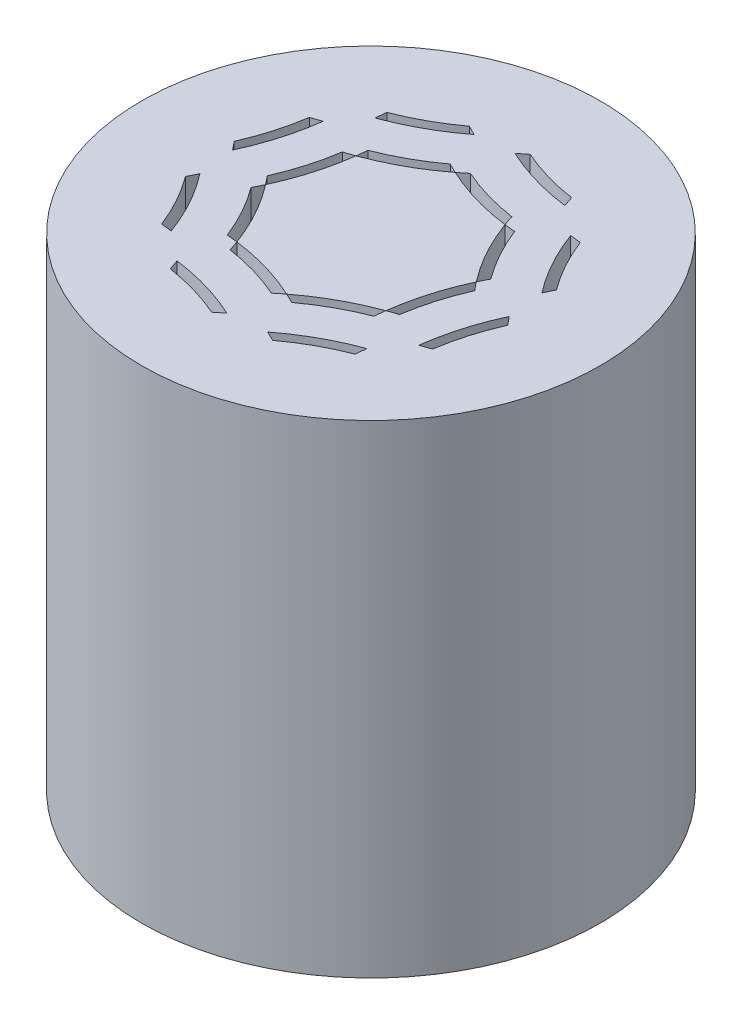
from build123d import *

# Parameters (mm, degrees)
SKETCH1_R           = 4.75
BOSS_EXTRUDE1_DEPTH = 10
CUT_EXTRUDE8_DEPTH  = 10
BOSS_EXTRUDE2_DEPTH = 10
CUT_EXTRUDE9_DEPTH  = 10
CIRPATTERN1_COUNT   = 8
SCALE3_SCALE        = 5
SKETCH7_R           = 8.75
BOSS_EXTRUDE3_DEPTH = 5


with BuildPart() as part:
    # Sketch1 → Boss-Extrude1 (new body)
    with BuildSketch(Plane(origin=(0, 0, 0), x_dir=(1, 0, 0), z_dir=(0, 1, 0))):
        with Locations(Location((0, 0, 0), (0, 0, 270))):
            Circle(SKETCH1_R)
    extrude(amount=BOSS_EXTRUDE1_DEPTH)

    # Sketch2 → Cut-Extrude8 (cut)
    with BuildSketch(Plane(origin=(0, 10, 0), x_dir=(1, 0, 0), z_dir=(0, 1, 0))):
        with BuildLine():
            ThreePointArc((-0.218792633, 1.963882563), (-0.319780571, 2.012220784), (-0.419649419, 2.062830667))
            ThreePointArc((-0.419649419, 2.062830667), (-0.949572254, 1.723202116), (-1.519747642, 1.456620438))
            ThreePointArc((-1.519747642, 1.456620438), (-1.530306935, 1.345159016), (-1.543384432, 1.233964924))
            ThreePointArc((-1.543384432, 1.233964924), (-0.853047192, 1.54803673), (-0.218792633, 1.963882563))
        make_face()
        with BuildLine():
            ThreePointArc((-0.044637674, 2.104610052), (-0.145319358, 2.150297375), (-0.244910404, 2.198315668))
            ThreePointArc((-0.244910404, 2.198315668), (-0.331491458, 2.129556275), (-0.419649419, 2.062830667))
            ThreePointArc((-0.419649419, 2.062830667), (-0.319780571, 2.012220784), (-0.218792633, 1.963882563))
            ThreePointArc((-0.218792633, 1.963882563), (-0.130919349, 2.033261473), (-0.044637674, 2.104610052))
        make_face()
        with BuildLine():
            ThreePointArc((1.161904603, 1.755378503), (0.547038921, 1.889936882), (-0.044637674, 2.104610052))
            ThreePointArc((-0.044637674, 2.104610052), (-0.130919349, 2.033261473), (-0.218792633, 1.963882563))
            ThreePointArc((-0.218792633, 1.963882563), (0.491431815, 1.697822724), (1.233964924, 1.543384432))
            ThreePointArc((1.233964924, 1.543384432), (1.196735951, 1.648973971), (1.161904603, 1.755378503))
        make_face()
        with BuildLine():
            ThreePointArc((1.381266108, 1.727621723), (1.271423825, 1.740223541), (1.161904603, 1.755378503))
            ThreePointArc((1.161904603, 1.755378503), (1.196735951, 1.648973971), (1.233964924, 1.543384432))
            ThreePointArc((1.233964924, 1.543384432), (1.345159016, 1.530306935), (1.456620438, 1.519747642))
            ThreePointArc((1.456620438, 1.519747642), (1.417733552, 1.623246159), (1.381266108, 1.727621723))
        make_face()
        with BuildLine():
            ThreePointArc((1.456620438, 1.519747642), (1.345159016, 1.530306935), (1.233964924, 1.543384432))
            ThreePointArc((1.233964924, 1.543384432), (1.54803673, 0.853047192), (1.963882563, 0.218792633))
            ThreePointArc((1.963882563, 0.218792633), (2.012220784, 0.319780571), (2.062830667, 0.419649419))
            ThreePointArc((2.062830667, 0.419649419), (1.723202116, 0.949572254), (1.456620438, 1.519747642))
        make_face()
        with BuildLine():
            ThreePointArc((2.062830667, 0.419649419), (2.012220784, 0.319780571), (1.963882563, 0.218792633))
            ThreePointArc((1.963882563, 0.218792633), (2.033261473, 0.130919349), (2.104610052, 0.044637674))
            ThreePointArc((2.104610052, 0.044637674), (2.150297375, 0.145319358), (2.198315668, 0.244910404))
            ThreePointArc((2.198315668, 0.244910404), (2.129556275, 0.331491458), (2.062830667, 0.419649419))
        make_face()
        with BuildLine():
            ThreePointArc((2.104610052, 0.044637674), (2.033261473, 0.130919349), (1.963882563, 0.218792633))
            ThreePointArc((1.963882563, 0.218792633), (1.697822724, -0.491431815), (1.543384432, -1.233964924))
            ThreePointArc((1.543384432, -1.233964924), (1.648973971, -1.196735951), (1.755378503, -1.161904603))
            ThreePointArc((1.755378503, -1.161904603), (1.889936882, -0.547038921), (2.104610052, 0.044637674))
        make_face()
        with BuildLine():
            ThreePointArc((1.755378503, -1.161904603), (1.648973971, -1.196735951), (1.543384432, -1.233964924))
            ThreePointArc((1.543384432, -1.233964924), (1.530306935, -1.345159016), (1.519747642, -1.456620438))
            ThreePointArc((1.519747642, -1.456620438), (1.623246159, -1.417733552), (1.727621723, -1.381266108))
            ThreePointArc((1.727621723, -1.381266108), (1.740223541, -1.271423825), (1.755378503, -1.161904603))
        make_face()
        with BuildLine():
            ThreePointArc((1.519747642, -1.456620438), (1.530306935, -1.345159016), (1.543384432, -1.233964924))
            ThreePointArc((1.543384432, -1.233964924), (0.853047192, -1.54803673), (0.218792633, -1.963882563))
            ThreePointArc((0.218792633, -1.963882563), (0.319780571, -2.012220784), (0.419649419, -2.062830667))
            ThreePointArc((0.419649419, -2.062830667), (0.949572254, -1.723202116), (1.519747642, -1.456620438))
        make_face()
        with BuildLine():
            ThreePointArc((0.419649419, -2.062830667), (0.319780571, -2.012220784), (0.218792633, -1.963882563))
            ThreePointArc((0.218792633, -1.963882563), (0.130919349, -2.033261473), (0.044637674, -2.104610052))
            ThreePointArc((0.044637674, -2.104610052), (0.145319358, -2.150297375), (0.244910404, -2.198315668))
            ThreePointArc((0.244910404, -2.198315668), (0.331491458, -2.129556275), (0.419649419, -2.062830667))
        make_face()
        with BuildLine():
            ThreePointArc((0.218792633, -1.963882563), (-0.491431815, -1.697822724), (-1.233964924, -1.543384432))
            ThreePointArc((-1.233964924, -1.543384432), (-1.196735951, -1.648973971), (-1.161904603, -1.755378503))
            ThreePointArc((-1.161904603, -1.755378503), (-0.547038921, -1.889936882), (0.044637674, -2.104610052))
            ThreePointArc((0.044637674, -2.104610052), (0.130919349, -2.033261473), (0.218792633, -1.963882563))
        make_face()
        with BuildLine():
            ThreePointArc((-1.161904603, -1.755378503), (-1.196735951, -1.648973971), (-1.233964924, -1.543384432))
            ThreePointArc((-1.233964924, -1.543384432), (-1.345159016, -1.530306935), (-1.456620438, -1.519747642))
            ThreePointArc((-1.456620438, -1.519747642), (-1.417733552, -1.623246159), (-1.381266108, -1.727621723))
            ThreePointArc((-1.381266108, -1.727621723), (-1.271423825, -1.740223541), (-1.161904603, -1.755378503))
        make_face()
        with BuildLine():
            ThreePointArc((-1.233964924, -1.543384432), (-1.54803673, -0.853047192), (-1.963882563, -0.218792633))
            ThreePointArc((-1.963882563, -0.218792633), (-2.012220784, -0.319780571), (-2.062830667, -0.419649419))
            ThreePointArc((-2.062830667, -0.419649419), (-1.723202116, -0.949572254), (-1.456620438, -1.519747642))
            ThreePointArc((-1.456620438, -1.519747642), (-1.345159016, -1.530306935), (-1.233964924, -1.543384432))
        make_face()
        with BuildLine():
            ThreePointArc((-2.062830667, -0.419649419), (-2.012220784, -0.319780571), (-1.963882563, -0.218792633))
            ThreePointArc((-1.963882563, -0.218792633), (-2.033261473, -0.130919349), (-2.104610052, -0.044637674))
            ThreePointArc((-2.104610052, -0.044637674), (-2.150297375, -0.145319358), (-2.198315668, -0.244910404))
            ThreePointArc((-2.198315668, -0.244910404), (-2.129556275, -0.331491458), (-2.062830667, -0.419649419))
        make_face()
        with BuildLine():
            ThreePointArc((-1.963882563, -0.218792633), (-1.697822724, 0.491431815), (-1.543384432, 1.233964924))
            ThreePointArc((-1.543384432, 1.233964924), (-1.648973971, 1.196735951), (-1.755378503, 1.161904603))
            ThreePointArc((-1.755378503, 1.161904603), (-1.889936882, 0.547038921), (-2.104610052, -0.044637674))
            ThreePointArc((-2.104610052, -0.044637674), (-2.033261473, -0.130919349), (-1.963882563, -0.218792633))
        make_face()
        with BuildLine():
            ThreePointArc((-1.543384432, 1.233964924), (-1.530306935, 1.345159016), (-1.519747642, 1.456620438))
            ThreePointArc((-1.519747642, 1.456620438), (-1.623246159, 1.417733552), (-1.727621723, 1.381266108))
            ThreePointArc((-1.727621723, 1.381266108), (-1.740223541, 1.271423825), (-1.755378503, 1.161904603))
            ThreePointArc((-1.755378503, 1.161904603), (-1.648973971, 1.196735951), (-1.543384432, 1.233964924))
        make_face()
    extrude(amount=-CUT_EXTRUDE8_DEPTH, mode=Mode.SUBTRACT)


with BuildPart() as cut_extrude8_piece_1:
    # of the separate pieces the step leaves, piece 1, a body of its own (cut_extrude8_pieces)
    add(part.part.solids().sort_by_distance((0, 0, 4.75))[0])

    # Sketch2<9> → Boss-Extrude2 (add)
    with BuildSketch(Plane(origin=(0, 10, 0), x_dir=(1, 0, 0), z_dir=(0, 1, 0))):
        with BuildLine():
            ThreePointArc((-0.044637674, 2.104610052), (-0.145319358, 2.150297375), (-0.244910404, 2.198315668))
            ThreePointArc((-0.244910404, 2.198315668), (-0.331491458, 2.129556275), (-0.419649419, 2.062830667))
            ThreePointArc((-0.419649419, 2.062830667), (-0.319780571, 2.012220784), (-0.218792633, 1.963882563))
            ThreePointArc((-0.218792633, 1.963882563), (-0.130919349, 2.033261473), (-0.044637674, 2.104610052))
        make_face()
        with BuildLine():
            ThreePointArc((1.381266108, 1.727621723), (1.271423825, 1.740223541), (1.161904603, 1.755378503))
            ThreePointArc((1.161904603, 1.755378503), (1.196735951, 1.648973971), (1.233964924, 1.543384432))
            ThreePointArc((1.233964924, 1.543384432), (1.345159016, 1.530306935), (1.456620438, 1.519747642))
            ThreePointArc((1.456620438, 1.519747642), (1.417733552, 1.623246159), (1.381266108, 1.727621723))
        make_face()
        with BuildLine():
            ThreePointArc((2.062830667, 0.419649419), (2.012220784, 0.319780571), (1.963882563, 0.218792633))
            ThreePointArc((1.963882563, 0.218792633), (2.033261473, 0.130919349), (2.104610052, 0.044637674))
            ThreePointArc((2.104610052, 0.044637674), (2.150297375, 0.145319358), (2.198315668, 0.244910404))
            ThreePointArc((2.198315668, 0.244910404), (2.129556275, 0.331491458), (2.062830667, 0.419649419))
        make_face()
        with BuildLine():
            ThreePointArc((1.755378503, -1.161904603), (1.648973971, -1.196735951), (1.543384432, -1.233964924))
            ThreePointArc((1.543384432, -1.233964924), (1.530306935, -1.345159016), (1.519747642, -1.456620438))
            ThreePointArc((1.519747642, -1.456620438), (1.623246159, -1.417733552), (1.727621723, -1.381266108))
            ThreePointArc((1.727621723, -1.381266108), (1.740223541, -1.271423825), (1.755378503, -1.161904603))
        make_face()
        with BuildLine():
            ThreePointArc((0.419649419, -2.062830667), (0.319780571, -2.012220784), (0.218792633, -1.963882563))
            ThreePointArc((0.218792633, -1.963882563), (0.130919349, -2.033261473), (0.044637674, -2.104610052))
            ThreePointArc((0.044637674, -2.104610052), (0.145319358, -2.150297375), (0.244910404, -2.198315668))
            ThreePointArc((0.244910404, -2.198315668), (0.331491458, -2.129556275), (0.419649419, -2.062830667))
        make_face()
        with BuildLine():
            ThreePointArc((-1.161904603, -1.755378503), (-1.196735951, -1.648973971), (-1.233964924, -1.543384432))
            ThreePointArc((-1.233964924, -1.543384432), (-1.345159016, -1.530306935), (-1.456620438, -1.519747642))
            ThreePointArc((-1.456620438, -1.519747642), (-1.417733552, -1.623246159), (-1.381266108, -1.727621723))
            ThreePointArc((-1.381266108, -1.727621723), (-1.271423825, -1.740223541), (-1.161904603, -1.755378503))
        make_face()
        with BuildLine():
            ThreePointArc((-2.062830667, -0.419649419), (-2.012220784, -0.319780571), (-1.963882563, -0.218792633))
            ThreePointArc((-1.963882563, -0.218792633), (-2.033261473, -0.130919349), (-2.104610052, -0.044637674))
            ThreePointArc((-2.104610052, -0.044637674), (-2.150297375, -0.145319358), (-2.198315668, -0.244910404))
            ThreePointArc((-2.198315668, -0.244910404), (-2.129556275, -0.331491458), (-2.062830667, -0.419649419))
        make_face()
        with BuildLine():
            ThreePointArc((-1.543384432, 1.233964924), (-1.530306935, 1.345159016), (-1.519747642, 1.456620438))
            ThreePointArc((-1.519747642, 1.456620438), (-1.623246159, 1.417733552), (-1.727621723, 1.381266108))
            ThreePointArc((-1.727621723, 1.381266108), (-1.740223541, 1.271423825), (-1.755378503, 1.161904603))
            ThreePointArc((-1.755378503, 1.161904603), (-1.648973971, 1.196735951), (-1.543384432, 1.233964924))
        make_face()
    extrude(amount=-BOSS_EXTRUDE2_DEPTH)

    # Sketch4 → Cut-Extrude9 (cut)
    with BuildSketch(Plane(origin=(0, 10, 0), x_dir=(1, 0, 0), z_dir=(0, 1, 0))):
        with BuildLine():
            Line((-0.701463709, 2.839684271), (-0.902320495, 2.938632375))
            ThreePointArc((-0.902320495, 2.938632375), (-1.43224333, 2.599003824), (-2.002418718, 2.332422146))
            Line((-2.002418718, 2.332422146), (-2.026055508, 2.109766632))
            ThreePointArc((-2.026055508, 2.109766632), (-1.335718268, 2.423838438), (-0.701463709, 2.839684271))
        make_face()
    cut_extrude9 = extrude(amount=-CUT_EXTRUDE9_DEPTH, mode=Mode.SUBTRACT)

    # CirPattern1: Cut-Extrude9 ×8 about axis
    cirpattern1_axis = Axis((0, 0, 0), (0, 1, 0))
    for i in range(1, CIRPATTERN1_COUNT):
        add(cut_extrude9.rotate(cirpattern1_axis, i * 360 / CIRPATTERN1_COUNT), mode=Mode.SUBTRACT)


with BuildPart() as cut_extrude8_piece_2:
    # of the separate pieces the step leaves, piece 2, a body of its own (cut_extrude8_pieces)
    add(part.part.solids().sort_by_distance((-1.543384432, 0, -1.233964924))[0])


with BuildPart() as cut_extrude8_piece_1_1:
    # Scale3: scaled about (0, 5, 0)
    add(cut_extrude8_piece_1.part.scale(SCALE3_SCALE).moved(Location((0, -20, 0))))


with BuildPart() as cut_extrude8_piece_2_1:
    # Scale3: scaled about (0, 5, 0)
    add(cut_extrude8_piece_2.part.scale(SCALE3_SCALE).moved(Location((0, -20, 0))))

    # Sketch7 → Boss-Extrude3 (add)
    with BuildSketch(Plane.XZ.offset(20)):
        with Locations(Location((0, 0, 0), (0, 0, 270))):
            Circle(SKETCH7_R)
    extrude(amount=BOSS_EXTRUDE3_DEPTH)


solid = Compound([cut_extrude8_piece_1_1.part, cut_extrude8_piece_2_1.part])
